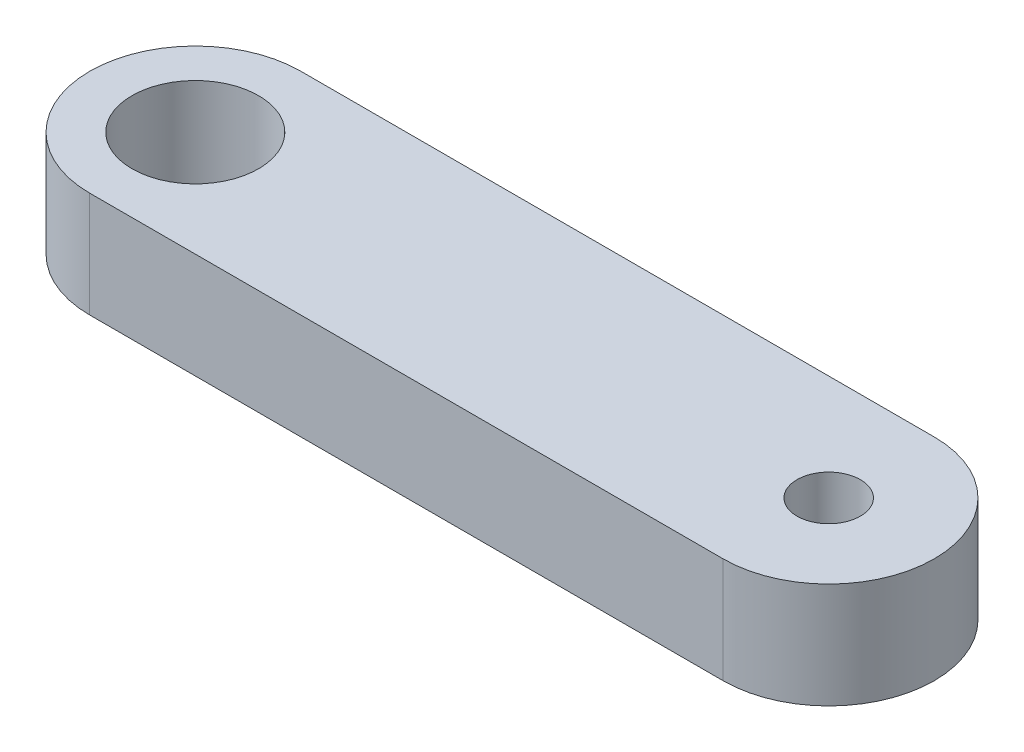
from build123d import *

# Parameters (mm, degrees)
BOSS_EXTRUDE2_DEPTH = 2.5
SKETCH6_R           = 1.5
CUT_EXTRUDE2_DEPTH  = 2.5
SKETCH7_R           = 0.75
CUT_EXTRUDE3_DEPTH  = 2.5


with BuildPart() as part:
    # Sketch5 → Boss-Extrude2 (new body)
    with BuildSketch(Plane(origin=(0, 0, 0), x_dir=(1, 0, 0), z_dir=(0, 1, 0))):
        with BuildLine():
            Line((0, 2.5), (15, 2.5))
            ThreePointArc((15, 2.5), (17.5, 0), (15, -2.5))
            Line((15, -2.5), (0, -2.5))
            ThreePointArc((0, -2.5), (-2.5, 0), (0, 2.5))
        make_face()
    extrude(amount=BOSS_EXTRUDE2_DEPTH)

    # Sketch6 → Cut-Extrude2 (cut)
    with BuildSketch(Plane(origin=(0, 2.5, 0), x_dir=(1, 0, 0), z_dir=(0, 1, 0))):
        with Locations(Location((0, 0, 0), (0, 0, 270))):
            Circle(SKETCH6_R)
    extrude(amount=-CUT_EXTRUDE2_DEPTH, mode=Mode.SUBTRACT)

    # Sketch7 → Cut-Extrude3 (cut)
    with BuildSketch(Plane(origin=(0, 2.5, 0), x_dir=(1, 0, 0), z_dir=(0, 1, 0))):
        with Locations(Location((15, 0, 0), (0, 0, 270))):
            Circle(SKETCH7_R)
    extrude(amount=-CUT_EXTRUDE3_DEPTH, mode=Mode.SUBTRACT)


solid = part.part
